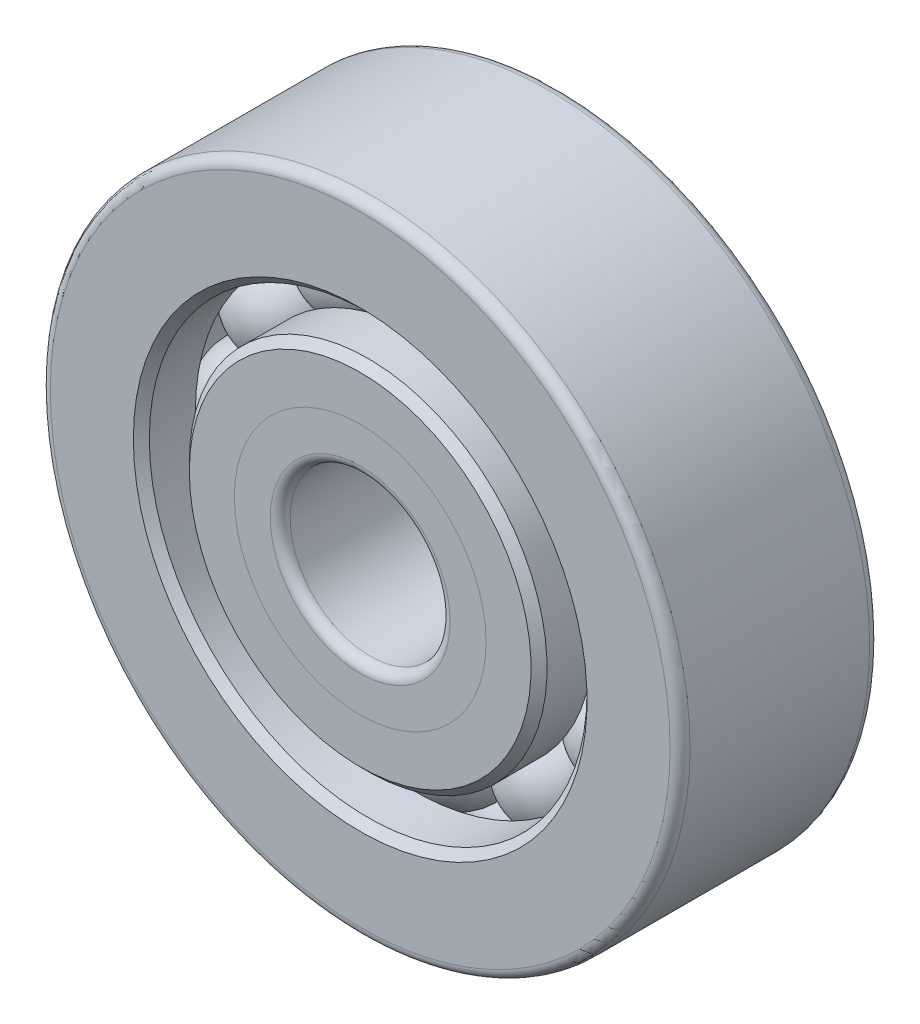
from build123d import *

# Parameters (mm, degrees)
SKETCH3_W              = 7.9248
SKETCH3_H              = 3.926586
SKETCH3_H_2            = 4.010406
SKETCH4_R              = 1.98501
CIRPATTERN1_COUNT      = 12
FILLET1_R              = 0.39624
FILLET2_R              = 0.39624
CHAMFER1_SIZE          = 0.316992
CHAMFER2_SIZE          = 0.316992
SPLIT1_SURFACE_1_BACK  = 37.785
SPLIT1_SURFACE_1_DEPTH = 75.57
SPLIT1_SURFACE_2_BACK  = 37.785
SPLIT1_SURFACE_2_DEPTH = 75.57


with BuildPart() as part:
    # Sketch3 → Revolve2 (revolve)
    with BuildSketch(Plane(origin=(0, 0, 0), x_dir=(0, 0, -1), z_dir=(1, 0, 0)), mode=Mode.PRIVATE) as revolve2_sk:
        with Locations((0, 5.138293)):
            Rectangle(SKETCH3_W, SKETCH3_H)
        with Locations((0, 10.694797)):
            Rectangle(SKETCH3_W, SKETCH3_H_2)
    revolve(revolve2_sk.sketch.rotate(Axis((0, 0, 3.9624), (0, 0, -1)), 90), axis=Axis((0, 0, 3.9624), (0, 0, -1)))

    # Sketch4 → Cut-Revolve1 (revolve, cut)
    with BuildSketch(Plane(origin=(0, 0, 0), x_dir=(0, 0, -1), z_dir=(1, 0, 0)), mode=Mode.PRIVATE) as cut_revolve1_sk:
        with Locations((0, 7.89559)):
            Circle(SKETCH4_R)
    revolve(cut_revolve1_sk.sketch.rotate(Axis((0, 0, 3.9624), (0, 0, -1)), 90), axis=Axis((0, 0, 3.9624), (0, 0, -1)), mode=Mode.SUBTRACT)

    # Fillet1
    fillet1_edges = [part.edges().sort_by_distance(p)[0] for p in [
        (-12.7, 0, -3.9624),
        (-12.7, 0, 3.9624),
    ]]
    fillet(fillet1_edges, radius=FILLET1_R)

    # Fillet2
    fillet2_edges = [part.edges().sort_by_distance(p)[0] for p in [
        (-3.175, 0, 3.9624),
        (-3.175, 0, -3.9624),
    ]]
    fillet(fillet2_edges, radius=FILLET2_R)

    # Chamfer1
    chamfer1_edges = [part.edges().sort_by_distance(p)[0] for p in [
        (-8.689594, 0, -3.9624),
        (-8.689594, 0, 3.9624),
    ]]
    chamfer(chamfer1_edges, length=CHAMFER1_SIZE)

    # Chamfer2
    chamfer2_edges = [part.edges().sort_by_distance(p)[0] for p in [
        (-7.101586, 0, 3.9624),
        (-7.101586, 0, -3.9624),
    ]]
    chamfer(chamfer2_edges, length=CHAMFER2_SIZE)


with BuildPart() as body_2:
    # Sketch5 → Revolve3 (revolve)
    with BuildSketch(Plane(origin=(0, 0, 0), x_dir=(0, 0, -1), z_dir=(1, 0, 0))):
        with BuildLine():
            Line((-1.98501, 7.89559), (1.98501, 7.89559))
            ThreePointArc((1.98501, 7.89559), (0, 9.8806), (-1.98501, 7.89559))
        make_face()
    revolve(axis=Axis((0, 7.89559, 1.98501), (0, 0, -1)))


with BuildPart() as cirpattern1_1:
    # CirPattern1: pattern copy
    add(body_2.part.rotate(Axis((0, 0, 0), (0, 0, 1)), 1 * 360 / CIRPATTERN1_COUNT))


with BuildPart() as cirpattern1_2:
    # CirPattern1: pattern copy
    add(body_2.part.rotate(Axis((0, 0, 0), (0, 0, 1)), 2 * 360 / CIRPATTERN1_COUNT))


with BuildPart() as cirpattern1_3:
    # CirPattern1: pattern copy
    add(body_2.part.rotate(Axis((0, 0, 0), (0, 0, 1)), 3 * 360 / CIRPATTERN1_COUNT))


with BuildPart() as cirpattern1_4:
    # CirPattern1: pattern copy
    add(body_2.part.rotate(Axis((0, 0, 0), (0, 0, 1)), 4 * 360 / CIRPATTERN1_COUNT))


with BuildPart() as cirpattern1_5:
    # CirPattern1: pattern copy
    add(body_2.part.rotate(Axis((0, 0, 0), (0, 0, 1)), 5 * 360 / CIRPATTERN1_COUNT))


with BuildPart() as cirpattern1_6:
    # CirPattern1: pattern copy
    add(body_2.part.rotate(Axis((0, 0, 0), (0, 0, 1)), 6 * 360 / CIRPATTERN1_COUNT))


with BuildPart() as cirpattern1_7:
    # CirPattern1: pattern copy
    add(body_2.part.rotate(Axis((0, 0, 0), (0, 0, 1)), 7 * 360 / CIRPATTERN1_COUNT))


with BuildPart() as cirpattern1_8:
    # CirPattern1: pattern copy
    add(body_2.part.rotate(Axis((0, 0, 0), (0, 0, 1)), 8 * 360 / CIRPATTERN1_COUNT))


with BuildPart() as cirpattern1_9:
    # CirPattern1: pattern copy
    add(body_2.part.rotate(Axis((0, 0, 0), (0, 0, 1)), 9 * 360 / CIRPATTERN1_COUNT))


with BuildPart() as cirpattern1_10:
    # CirPattern1: pattern copy
    add(body_2.part.rotate(Axis((0, 0, 0), (0, 0, 1)), 10 * 360 / CIRPATTERN1_COUNT))


with BuildPart() as cirpattern1_11:
    # CirPattern1: pattern copy
    add(body_2.part.rotate(Axis((0, 0, 0), (0, 0, 1)), 11 * 360 / CIRPATTERN1_COUNT))


with BuildPart() as body_14:
    # Split1: the piece behind the surface
    add(part.part)
    # Split1 surface: a surface, the sketch's curves swept straight by 75.57 mm
    with BuildLine(Plane.XY.offset(-SPLIT1_SURFACE_1_BACK), mode=Mode.PRIVATE) as split1_surface_1_path:
        CenterArc((0, 0), 4.99872, 0, 360)
    split1_surface_1 = Shell.extrude(split1_surface_1_path.wire(), (0 * SPLIT1_SURFACE_1_DEPTH, 0 * SPLIT1_SURFACE_1_DEPTH, 1 * SPLIT1_SURFACE_1_DEPTH))
    split(bisect_by=split1_surface_1, keep=Keep.BOTTOM)


with BuildPart() as part_1:
    add(part.part)

    # Split1: split by a surface, the side it looks to stays
    # Split1 surface: a surface, the sketch's curves swept straight by 75.57 mm
    with BuildLine(Plane.XY.offset(-SPLIT1_SURFACE_2_BACK), mode=Mode.PRIVATE) as split1_surface_2_path:
        CenterArc((0, 0), 4.99872, 0, 360)
    split1_surface_2 = Shell.extrude(split1_surface_2_path.wire(), (0 * SPLIT1_SURFACE_2_DEPTH, 0 * SPLIT1_SURFACE_2_DEPTH, 1 * SPLIT1_SURFACE_2_DEPTH))
    split(bisect_by=split1_surface_2, keep=Keep.TOP)


solid = Compound([body_2.part, cirpattern1_1.part, cirpattern1_2.part, cirpattern1_3.part, cirpattern1_4.part, cirpattern1_5.part, cirpattern1_6.part, cirpattern1_7.part, cirpattern1_8.part, cirpattern1_9.part, cirpattern1_10.part, cirpattern1_11.part, body_14.part, part_1.part])
